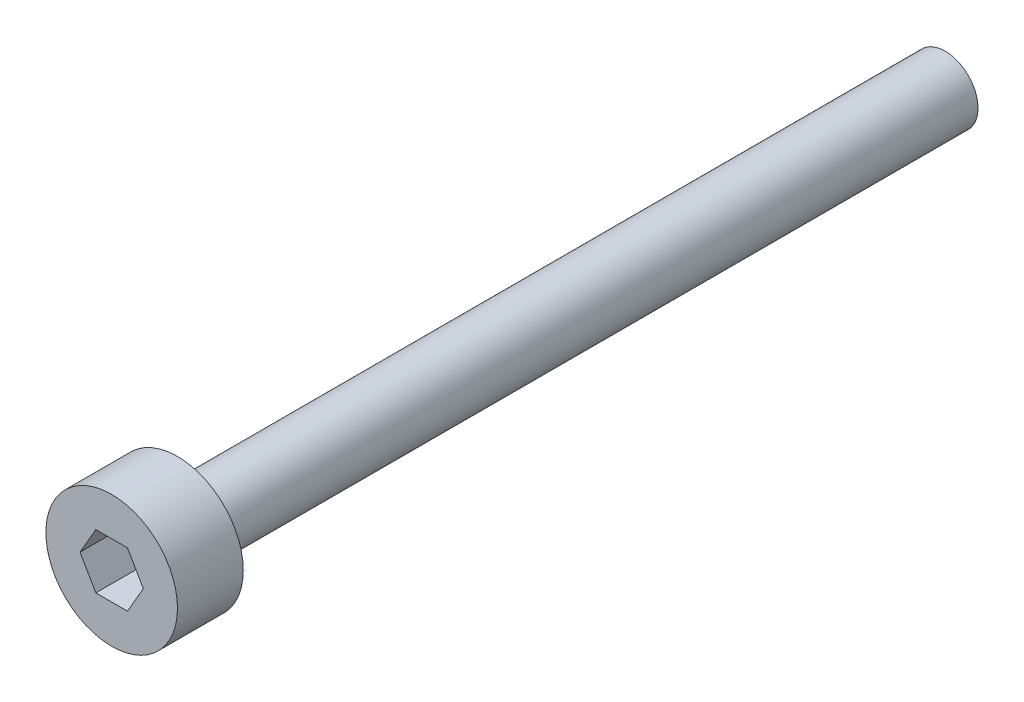
from build123d import *

# Parameters (mm, degrees)
SKETCH_5_R          = 3
EXTRUDE_1_DEPTH     = 3
CUT_EXTRUDE_1_DEPTH = 2
SKETCH_7_R          = 1.5
EXTRUDE_2_DEPTH     = 35


with BuildPart() as part:
    # ｽｹｯﾁ5 → ﾎﾞｽ - 押し出し1 (new body)
    with BuildSketch(Plane.XY):
        Circle(SKETCH_5_R)
    extrude(amount=EXTRUDE_1_DEPTH)

    # ｽｹｯﾁ6 → ｶｯﾄ - 押し出し1 (cut)
    with BuildSketch(Plane.XY.offset(3)):
        Polygon((1.443375673, 0), (0.721687836, 1.25), (-0.721687836, 1.25), (-1.443375673, 0), (-0.721687836, -1.25), (0.721687836, -1.25), align=None)
    extrude(amount=-CUT_EXTRUDE_1_DEPTH, mode=Mode.SUBTRACT)

    # ｽｹｯﾁ7 → ﾎﾞｽ - 押し出し2 (add)
    with BuildSketch(Plane(origin=(0, 0, 0), x_dir=(-1, 0, 0), z_dir=(0, 0, -1))):
        Circle(SKETCH_7_R)
    extrude(amount=EXTRUDE_2_DEPTH)


solid = part.part
